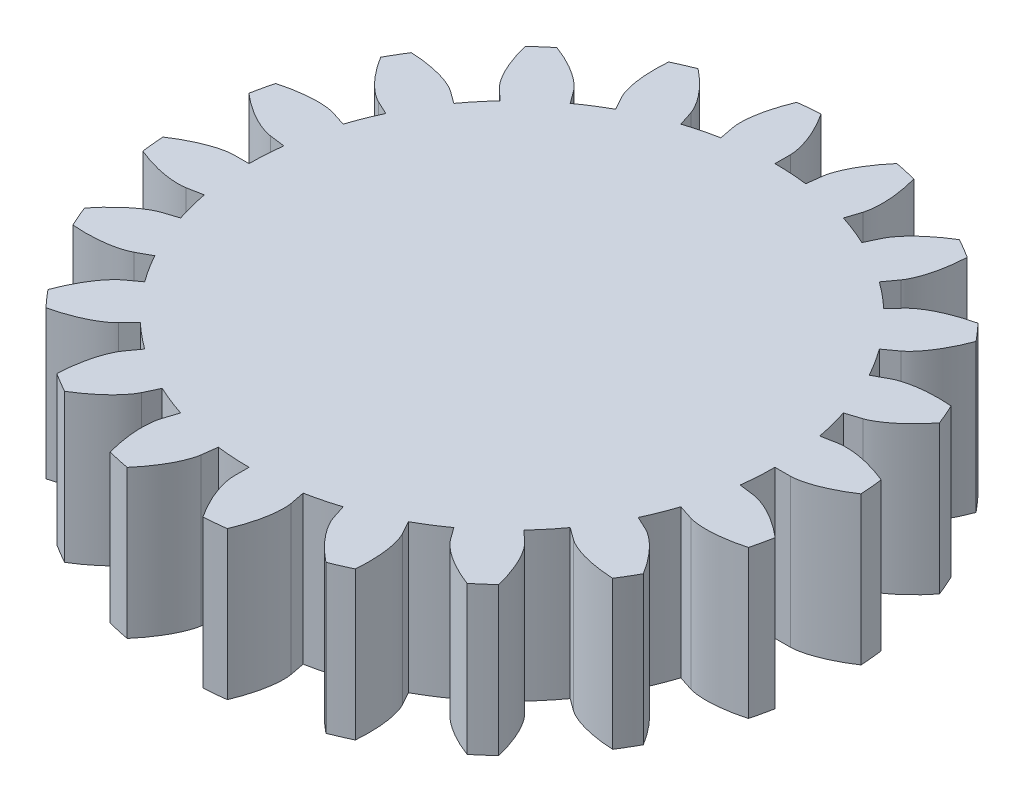
from build123d import *

# Parameters (mm, degrees)
GEAR_BILLET_R             = 22.25
GEAR_BILLET_EXTRUDE_DEPTH = 10
CUT_TOOTH_PROFILE_REACH   = 35.017
DUPLICATE_TEETH_COUNT     = 20


with BuildPart() as part:
    # Gear billet → Gear billet Extrude (new body)
    with BuildSketch(Plane(origin=(0, 0, 0), x_dir=(1, 0, 0), z_dir=(0, 1, 0))):
        Circle(GEAR_BILLET_R)
    extrude(amount=GEAR_BILLET_EXTRUDE_DEPTH)

    # Tooth profile → Cut tooth profile (cut, up to next)
    with BuildSketch(Plane(origin=(0, 10, 0), x_dir=(1, 0, 0), z_dir=(0, 1, 0)), mode=Mode.PRIVATE) as cut_tooth_profile_sk1:
        with BuildLine():
            Line((0, 18.793852416), (0, 17.75))
            ThreePointArc((0, 17.75), (1.108967305, 17.715323636), (2.213601657, 17.61143003))
            Line((2.213601657, 17.61143003), (2.343780442, 18.647133342))
            add(Edge.make_bspline(
                [(2.343780442, 18.647133342), (2.351011327, 18.704662307), (2.378887105, 18.864728711), (2.46229111, 19.163772783), (2.639630726, 19.635780315), (2.929185047, 20.221897371), (3.32923471, 20.875676419), (3.696503264, 21.374070321), (3.965266569, 21.702604471), (4.107167702, 21.86763987)],
                knots=[0, 0, 0, 0, 0, 0.005604071, 0.015718253, 0.029959921, 0.048733673, 0.068727069, 0.089783319, 0.089783319, 0.089783319, 0.089783319, 0.089783319], degree=4))
            ThreePointArc((4.107167702, 21.86763987), (1.390113946, 22.206532445), (-1.347991704, 22.209129167))
            add(Edge.make_bspline(
                [(0, 18.793852416), (0, 18.851834029), (-0.007696285, 19.014127221), (-0.053155403, 19.321238038), (-0.170246535, 19.811676735), (-0.384445745, 20.429328423), (-0.699839562, 21.12789375), (-1.002086259, 21.668198854), (-1.227779916, 22.027685677), (-1.347991704, 22.209129167)],
                knots=[0, 0, 0, 0, 0, 0.005604071, 0.015718253, 0.029959921, 0.048733673, 0.068727069, 0.089783319, 0.089783319, 0.089783319, 0.089783319, 0.089783319], degree=4))
        make_face()
    cut_tooth_profile_tool1 = extrude(cut_tooth_profile_sk1.sketch, amount=-CUT_TOOTH_PROFILE_REACH, mode=Mode.PRIVATE) & part.part
    cut_tooth_profile = cut_tooth_profile_tool1.solids().sort_by_distance((1.271255, 10, -20.307814))[0]
    add(cut_tooth_profile, mode=Mode.SUBTRACT)

    # Duplicate teeth: Cut tooth profile ×20 about axis
    duplicate_teeth_axis = Axis((0, 10, 0), (0, -1, 0))
    for i in range(1, DUPLICATE_TEETH_COUNT):
        add(cut_tooth_profile.rotate(duplicate_teeth_axis, i * 360 / DUPLICATE_TEETH_COUNT), mode=Mode.SUBTRACT)


solid = part.part
